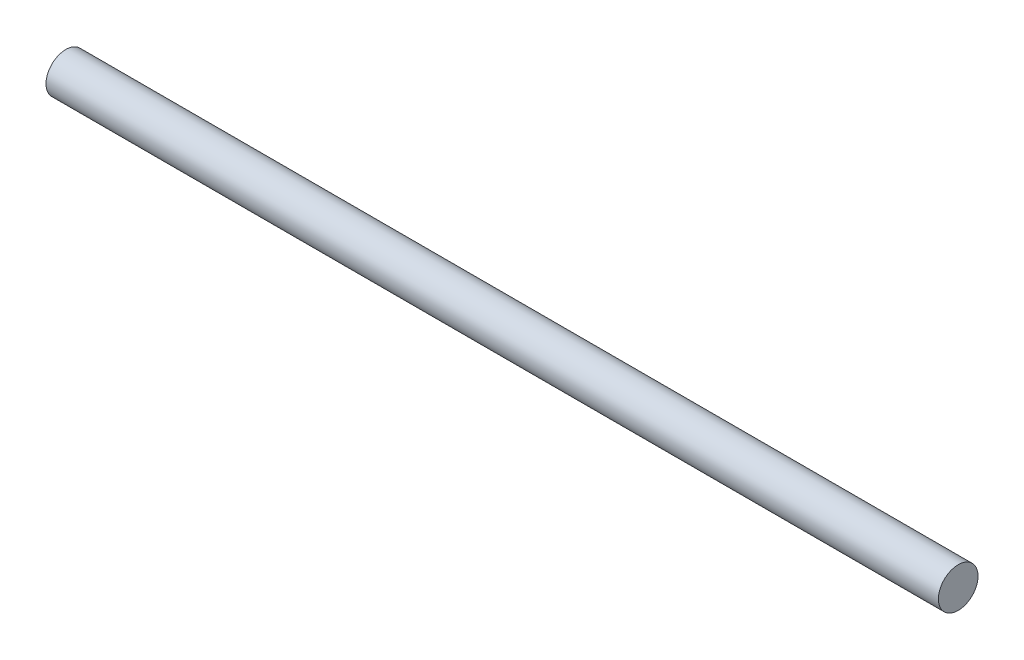
from build123d import *

# Parameters (mm, degrees)
SKETCH1_R           = 1
BOSS_EXTRUDE1_DEPTH = 45


with BuildPart() as part:
    # Sketch1 → Boss-Extrude1 (new body)
    with BuildSketch(Plane(origin=(0, 0, 0), x_dir=(0, 0, -1), z_dir=(1, 0, 0))):
        with Locations(Location((0, 0, 0), (0, 0, 180))):
            Circle(SKETCH1_R)
    extrude(amount=BOSS_EXTRUDE1_DEPTH)


solid = part.part
